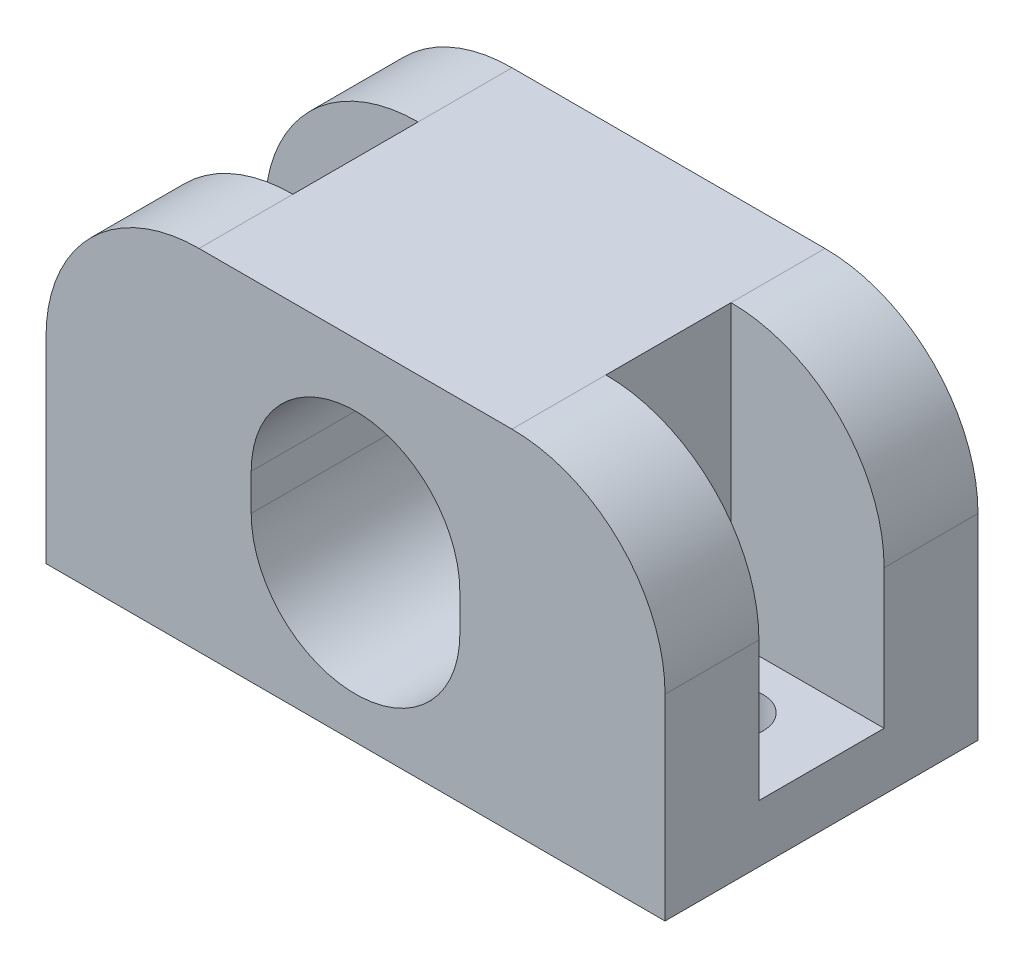
from build123d import *

# Parameters (mm, degrees)
BOSS_EXTRUDE1_DEPTH = 15
SKETCH2_W           = 7.335
SKETCH2_H           = 6
CUT_EXTRUDE1_DEPTH  = 14
SKETCH2_3_R         = 1.5
CUT_EXTRUDE2_DEPTH  = 27.937700811


with BuildPart() as part:
    # Sketch1 → Boss-Extrude1 (new body)
    with BuildSketch(Plane.XY):
        with BuildLine():
            Line((0, -2), (-14.835, -2))
            Line((-14.835, -2), (-14.835, 7.415))
            ThreePointArc((-14.835, 7.415), (-12.68662824, 12.60162824), (-7.5, 14.75))
            Line((-7.5, 14.75), (7.5, 14.75))
            ThreePointArc((7.5, 14.75), (12.68662824, 12.60162824), (14.835, 7.415))
            Line((14.835, 7.415), (14.835, -2))
            Line((14.835, -2), (0, -2))
        make_face()
        with BuildLine():
            Line((-5, 6.75), (-5, 5))
            ThreePointArc((-5, 5), (0, 0), (5, 5))
            Line((5, 5), (5, 6.75))
            ThreePointArc((5, 6.75), (0, 11.75), (-5, 6.75))
        make_face(mode=Mode.SUBTRACT)
    extrude(amount=-BOSS_EXTRUDE1_DEPTH)

    # Sketch2 → Cut-Extrude1 (cut)
    with BuildSketch(Plane(origin=(0, 14.75, 0), x_dir=(1, 0, 0), z_dir=(0, 1, 0))):
        with Locations((-11.1675, 7.5)):
            Rectangle(SKETCH2_W, SKETCH2_H)
    cut_extrude1 = extrude(amount=-CUT_EXTRUDE1_DEPTH, mode=Mode.SUBTRACT)

    # Sketch2<3> → Cut-Extrude2 (cut, through all)
    with BuildSketch(Plane(origin=(0, 14.75, 0), x_dir=(1, 0, 0), z_dir=(0, 1, 0))):
        with Locations((-10.54250606, 7.5)):
            Circle(SKETCH2_3_R)
    cut_extrude2 = extrude(amount=-CUT_EXTRUDE2_DEPTH, mode=Mode.SUBTRACT)

    # Mirror1: Cut-Extrude1, Cut-Extrude2 across plane
    add(cut_extrude1.mirror(Plane(origin=(0, 0, 0), x_dir=(0, 0, 1), z_dir=(1, 0, 0))), mode=Mode.SUBTRACT)
    add(cut_extrude2.mirror(Plane(origin=(0, 0, 0), x_dir=(0, 0, 1), z_dir=(1, 0, 0))), mode=Mode.SUBTRACT)


solid = part.part
